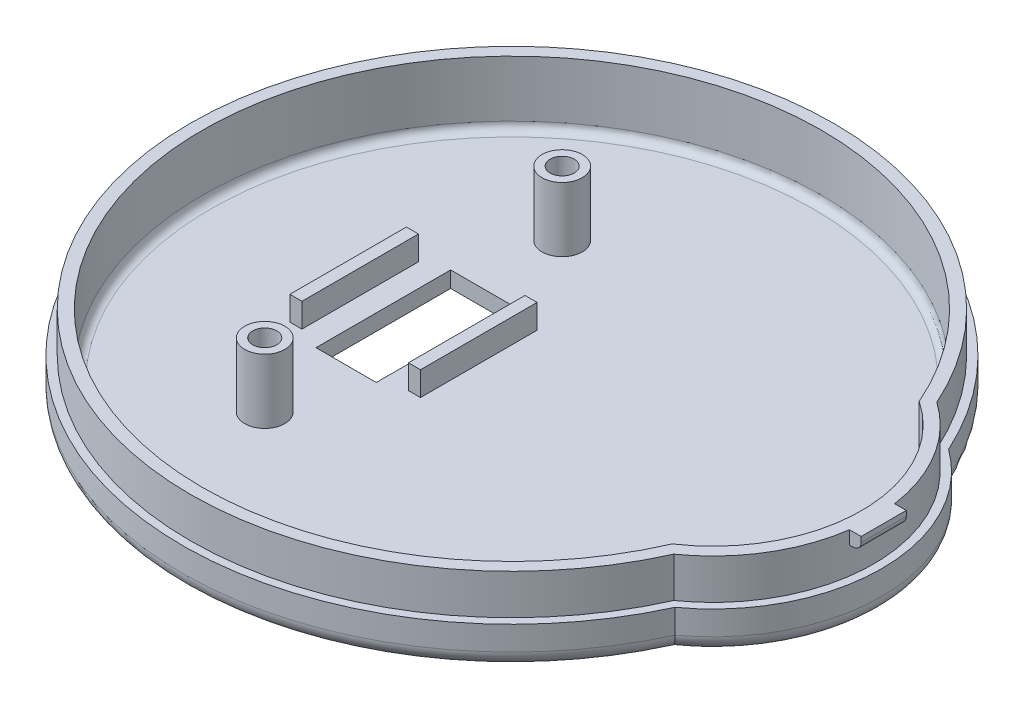
from build123d import *

# Parameters (mm, degrees)
BOSS_EXTRUDE3_DEPTH = 2
BOSS_EXTRUDE4_DEPTH = 10
BOSS_EXTRUDE5_DEPTH = 5
SKETCH11_W          = 2.5
SKETCH11_H          = 5.612132728
BOSS_EXTRUDE7_DEPTH = 1.65
FILLET2_R           = 1
SKETCH12_W          = 7.5
SKETCH12_H          = 16.75
CUT_EXTRUDE1_DEPTH  = 2
SKETCH17_W          = 1.5
SKETCH17_H          = 14.5
BOSS_EXTRUDE8_DEPTH = 3
SKETCH18_R          = 2.5
SKETCH18_R_2        = 1.5
BOSS_EXTRUDE9_DEPTH = 8
FILLET3_R           = 2
FILLET4_R           = 1


with BuildPart() as part:
    # Sketch4 → Boss-Extrude3 (new body)
    with BuildSketch(Plane(origin=(0, 0, 0), x_dir=(1, 0, 0), z_dir=(0, 1, 0))):
        with BuildLine():
            ThreePointArc((37.3, 17.020869543), (-41, 0), (37.3, -17.020869543))
            ThreePointArc((37.3, -17.020869543), (46, 0), (37.3, 17.020869543))
        make_face()
    extrude(amount=BOSS_EXTRUDE3_DEPTH)

    # Sketch4<5> → Boss-Extrude4 (add)
    with BuildSketch(Plane(origin=(0, 0, 0), x_dir=(1, 0, 0), z_dir=(0, 1, 0))):
        with BuildLine():
            ThreePointArc((36.5, 16.363068172), (-40, 0), (36.5, -16.363068172))
            ThreePointArc((36.5, -16.363068172), (45, 0), (36.5, 16.363068172))
        make_face()
        with BuildLine():
            ThreePointArc((35.3, -15.36749817), (43.5, 0), (35.3, 15.36749817))
            ThreePointArc((35.3, 15.36749817), (-38.5, 0), (35.3, -15.36749817))
        make_face(mode=Mode.SUBTRACT)
    extrude(amount=BOSS_EXTRUDE4_DEPTH)

    # Sketch4<6> → Boss-Extrude5 (add)
    with BuildSketch(Plane(origin=(0, 0, 0), x_dir=(1, 0, 0), z_dir=(0, 1, 0))):
        with BuildLine():
            ThreePointArc((37.3, 17.020869543), (-41, 0), (37.3, -17.020869543))
            ThreePointArc((37.3, -17.020869543), (46, 0), (37.3, 17.020869543))
        make_face()
        with BuildLine():
            ThreePointArc((36.5, -16.363068172), (45, 0), (36.5, 16.363068172))
            ThreePointArc((36.5, 16.363068172), (-40, 0), (36.5, -16.363068172))
        make_face(mode=Mode.SUBTRACT)
    extrude(amount=BOSS_EXTRUDE5_DEPTH)

    # Sketch11 → Boss-Extrude7 (add)
    with BuildSketch(Plane(origin=(0, 10, 0), x_dir=(1, 0, 0), z_dir=(0, 1, 0))):
        with Locations((45, 0)):
            Rectangle(SKETCH11_W, SKETCH11_H)
    extrude(amount=-BOSS_EXTRUDE7_DEPTH)

    # Fillet2
    fillet2_edges = [part.edges().sort_by_distance(p)[0] for p in [
        (46.25, 8.35, 0),
    ]]
    fillet(fillet2_edges, radius=FILLET2_R)

    # Sketch12 → Cut-Extrude1 (cut)
    with BuildSketch(Plane.XZ):
        with Locations((-12.25, 0)):
            Rectangle(SKETCH12_W, SKETCH12_H)
    extrude(amount=-CUT_EXTRUDE1_DEPTH, mode=Mode.SUBTRACT)

    # Sketch17 → Boss-Extrude8 (add)
    with BuildSketch(Plane(origin=(0, 2, 0), x_dir=(1, 0, 0), z_dir=(0, 1, 0))):
        Polygon((-5.625, 0), (-5.625, -7.25), (-4.125, -7.25), (-4.125, 7.25), (-5.625, 7.25), align=None)
        with Locations((-19.625, 0)):
            Rectangle(SKETCH17_W, SKETCH17_H)
    extrude(amount=BOSS_EXTRUDE8_DEPTH)

    # Sketch18 → Boss-Extrude9 (add)
    # profile 1 of 2: a face of its own
    with BuildSketch(Plane(origin=(0, 2, 0), x_dir=(1, 0, 0), z_dir=(0, 1, 0))):
        with Locations(Location((-12.25, -18.5, 0), (0, 0, 270))):
            Circle(SKETCH18_R)
        with Locations(Location((-12.25, -18.5, 0), (0, 0, 270))):
            Circle(SKETCH18_R_2, mode=Mode.SUBTRACT)
    # profile 2 of 2: a face of its own
    with BuildSketch(Plane(origin=(0, 2, 0), x_dir=(1, 0, 0), z_dir=(0, 1, 0))):
        with Locations(Location((-12.25, 18.5, 0), (0, 0, 270))):
            Circle(SKETCH18_R)
        with Locations(Location((-12.25, 18.5, 0), (0, 0, 270))):
            Circle(SKETCH18_R_2, mode=Mode.SUBTRACT)
    extrude(amount=BOSS_EXTRUDE9_DEPTH)

    # Fillet3
    fillet3_edges = [part.edges().sort_by_distance(p)[0] for p in [
        (46, 0, 0),
        (-41, 0, 0),
    ]]
    fillet(fillet3_edges, radius=FILLET3_R)

    # Fillet4
    fillet4_edges = [part.edges().sort_by_distance(p)[0] for p in [
        (43.5, 2, 0),
        (-38.5, 2, 0),
    ]]
    fillet(fillet4_edges, radius=FILLET4_R)


solid = part.part
